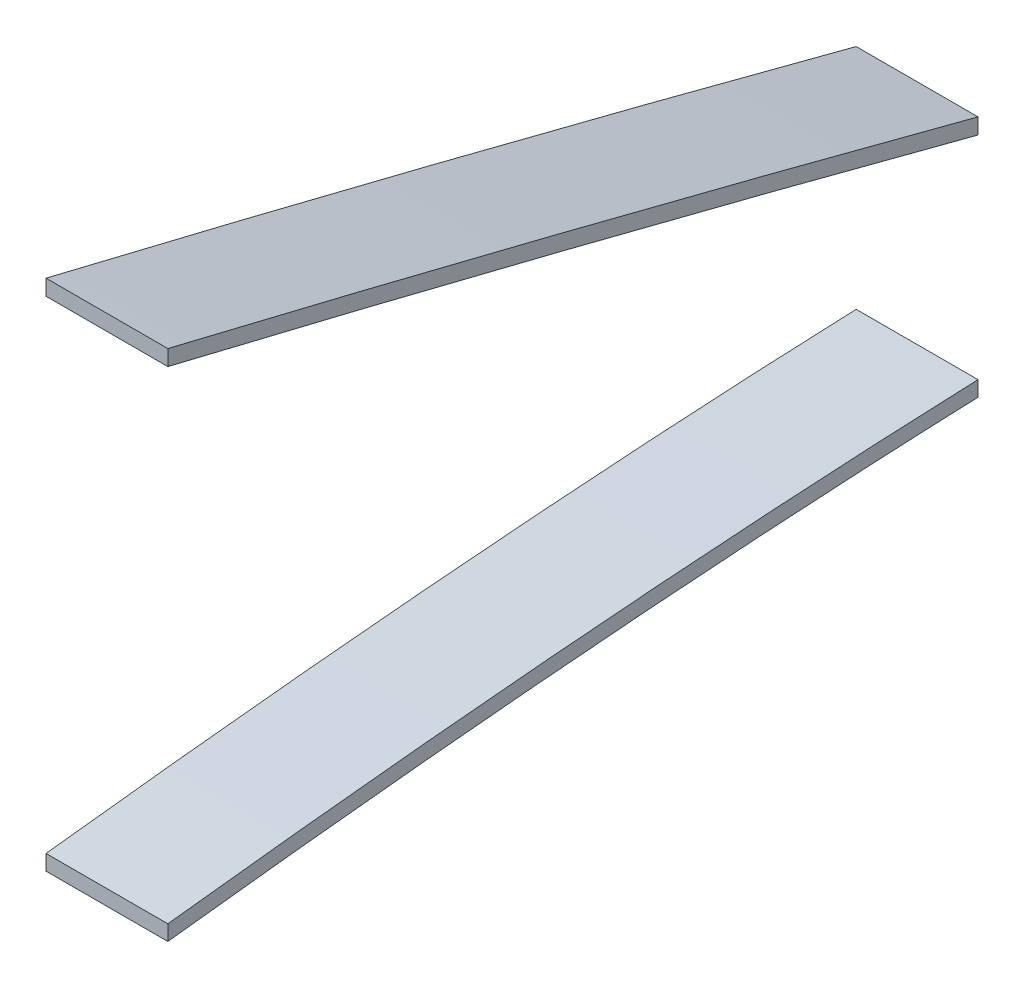
from build123d import *

# Parameters (mm, degrees)
BOSS_EXTRUDE1_DEPTH   = 6.35
BOSS_EXTRUDE1_2_DEPTH = 6.35


with BuildPart() as part:
    # Sketch1 → Boss-Extrude1 (new, symmetric)
    with BuildSketch(Plane(origin=(0, 0, 0), x_dir=(0, 0, -1), z_dir=(1, 0, 0))):
        with BuildLine():
            add(Edge.make_bspline(
                [(700.551053399, 3.586222224), (696.579883466, 4.636636464), (682.245101169, 8.399180811), (656.683490083, 14.958443735), (632.486605738, 20.949027091), (618.668198685, 24.282047812), (616.096053399, 24.899291701)],
                knots=[0.12762815, 0.12762815, 0.12762815, 0.12762815, 0.142399413, 0.180921149, 0.22252468, 0.232036611, 0.232036611, 0.232036611, 0.232036611], degree=3))
            Line((616.096053399, 24.899291701), (616.096053399, 23.267161102))
            add(Edge.make_bspline(
                [(700.551053399, 1.94501203), (695.881809342, 3.180712118), (674.780157381, 8.712406077), (646.635186109, 15.855600566), (623.117202697, 21.581456041), (616.096053399, 23.267161102)],
                knots=[0.127124743, 0.127124743, 0.127124743, 0.127124743, 0.144501553, 0.205602504, 0.23157986, 0.23157986, 0.23157986, 0.23157986], degree=3))
            Line((700.551053399, 1.94501203), (700.551053399, 3.586222224))
        make_face()
    extrude(amount=BOSS_EXTRUDE1_DEPTH, both=True)


with BuildPart() as body_2:
    # Sketch1 → Boss-Extrude1 2 (new, symmetric)
    with BuildSketch(Plane(origin=(0, 0, 0), x_dir=(0, 0, -1), z_dir=(1, 0, 0))):
        with BuildLine():
            add(Edge.make_bspline(
                [(616.096053399, -27.032599118), (619.843416737, -26.59006582), (640.917655955, -24.186794667), (669.061650625, -21.654412481), (693.517861944, -20.40563301), (700.551053399, -20.137154854)],
                knots=[0.781625644, 0.781625644, 0.781625644, 0.781625644, 0.794856204, 0.855992653, 0.880649492, 0.880649492, 0.880649492, 0.880649492], degree=3))
            Line((616.096053399, -27.032599118), (616.096053399, -28.630805543))
            add(Edge.make_bspline(
                [(616.096053399, -28.630805543), (627.126031636, -27.326648957), (650.742691726, -24.817450392), (678.920902179, -22.694532397), (696.049354723, -21.896959145), (700.551053399, -21.725128402)],
                knots=[0.781406307, 0.781406307, 0.781406307, 0.781406307, 0.820393483, 0.864765923, 0.880578814, 0.880578814, 0.880578814, 0.880578814], degree=3))
            Line((700.551053399, -21.725128402), (700.551053399, -20.137154854))
        make_face()
    extrude(amount=BOSS_EXTRUDE1_2_DEPTH, both=True)


solid = Compound([part.part, body_2.part])
